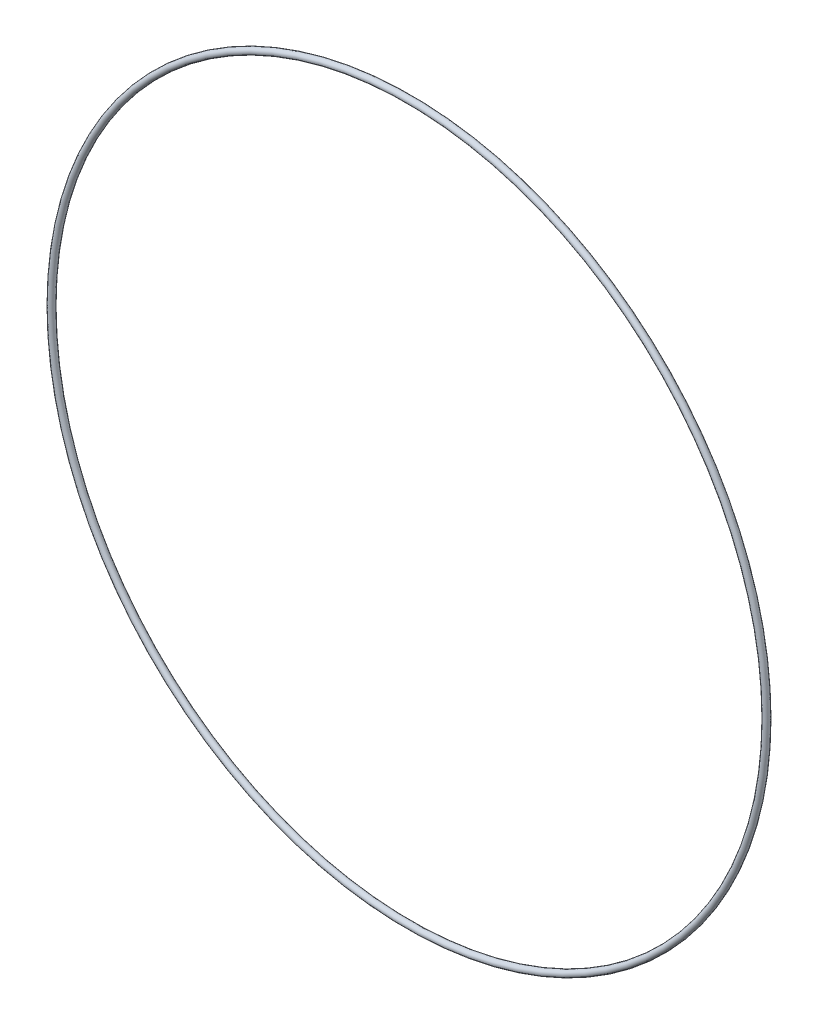
from build123d import *

# Parameters (mm, degrees)
SKETCH3_R = 1


with BuildPart() as part:
    # Sketch3 → Revolve1 (revolve)
    with BuildSketch(Plane(origin=(0, 0, 0), x_dir=(0, 0, -1), z_dir=(1, 0, 0)), mode=Mode.PRIVATE) as revolve1_sk:
        with Locations((0, 111.5)):
            Circle(SKETCH3_R)
    revolve(revolve1_sk.sketch.rotate(Axis((0, 0, 0), (0, 0, -1)), 90), axis=Axis((0, 0, 0), (0, 0, -1)))


solid = part.part
